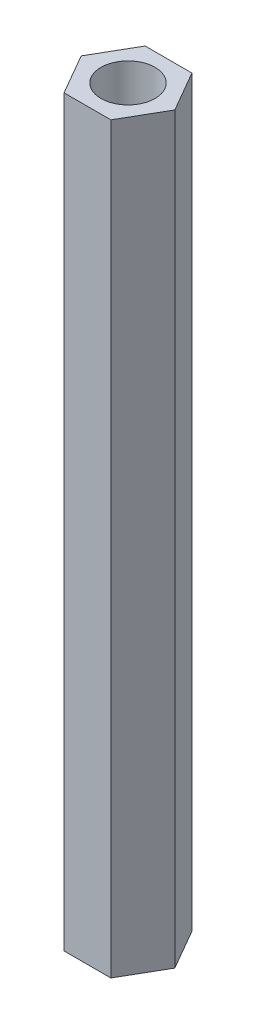
from build123d import *

# Parameters (mm, degrees)
SKETCH_1_R      = 2
EXTRUDE_1_DEPTH = 55


with BuildPart() as part:
    # 草图1 → 凸台-拉伸1 (new body)
    with BuildSketch(Plane(origin=(0, 0, 0), x_dir=(1, 0, 0), z_dir=(0, 1, 0))):
        Polygon((1.732050808, 3), (-1.732050808, 3), (-3.464101615, 0), (-1.732050808, -3), (1.732050808, -3), (3.464101615, 0), align=None)
        with Locations(Location((0, 0, 0), (0, 0, 270))):
            Circle(SKETCH_1_R, mode=Mode.SUBTRACT)
    extrude(amount=EXTRUDE_1_DEPTH)


solid = part.part
